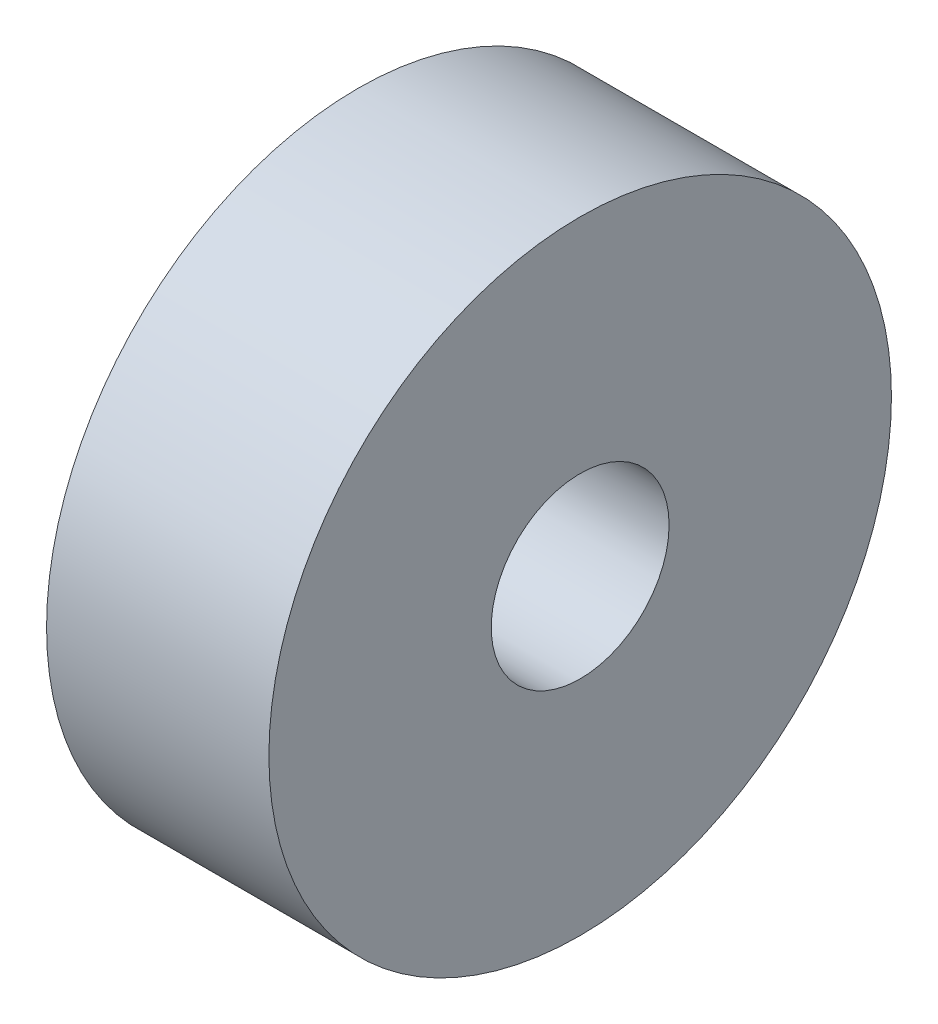
from build123d import *

# Parameters (mm, degrees)
SKETCH1_R           = 350
SKETCH1_R_2         = 100
BOSS_EXTRUDE1_DEPTH = 125


with BuildPart() as part:
    # Sketch1 → Boss-Extrude1 (new, symmetric)
    with BuildSketch(Plane(origin=(0, 0, 0), x_dir=(0, 0, -1), z_dir=(1, 0, 0))):
        Circle(SKETCH1_R)
        Circle(SKETCH1_R_2, mode=Mode.SUBTRACT)
    extrude(amount=BOSS_EXTRUDE1_DEPTH, both=True)


solid = part.part
